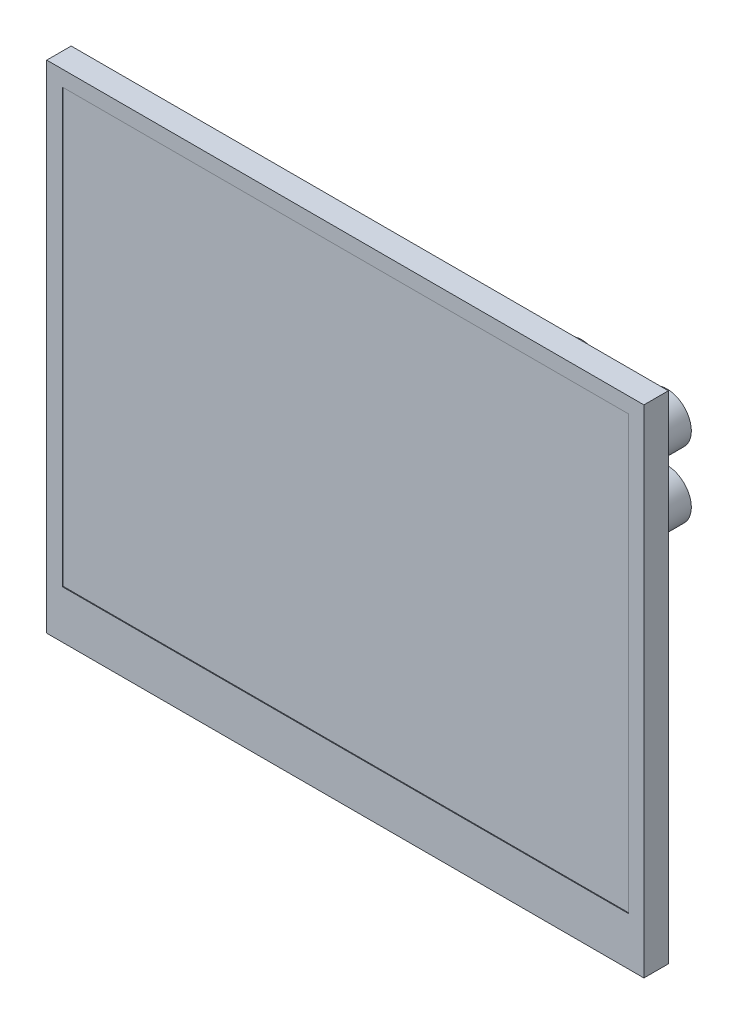
from build123d import *

# Parameters (mm, degrees)
SKETCH1_W           = 77
SKETCH1_H           = 64
BOSS_EXTRUDE1_DEPTH = 1.575
SKETCH2_W           = 56
SKETCH2_H           = 30
BOSS_EXTRUDE2_DEPTH = 4
SKETCH3_R           = 3.125
BOSS_EXTRUDE3_DEPTH = 6
SKETCH4_W           = 73
SKETCH4_H           = 55.8
CUT_EXTRUDE1_DEPTH  = 0.1


with BuildPart() as part:
    # Sketch1 → Boss-Extrude1 (new, symmetric)
    with BuildSketch(Plane.XY):
        Rectangle(SKETCH1_W, SKETCH1_H)
    extrude(amount=BOSS_EXTRUDE1_DEPTH, both=True)

    # Sketch2 → Boss-Extrude2 (add)
    with BuildSketch(Plane(origin=(0, 0, -1.575), x_dir=(-1, 0, 0), z_dir=(0, 0, -1))):
        with Locations((-6.5, 8.25)):
            Rectangle(SKETCH2_W, SKETCH2_H)
    extrude(amount=BOSS_EXTRUDE2_DEPTH)

    # Sketch3 → Boss-Extrude3 (add)
    with BuildSketch(Plane(origin=(0, 0, -5.575), x_dir=(-1, 0, 0), z_dir=(0, 0, -1))):
        with Locations((-28.335952563, 18.999270837)):
            Circle(SKETCH3_R)
        with Locations((-17.355937958, 18.999270837)):
            Circle(SKETCH3_R)
        with Locations((-28.335952563, 10.470489708)):
            Circle(SKETCH3_R)
        with BuildLine():
            Line((-6.150306614, 20.999270837), (0.349693386, 20.999270837))
            ThreePointArc((0.349693386, 20.999270837), (2.349693386, 18.999270837), (0.349693386, 16.999270837))
            Line((0.349693386, 16.999270837), (-6.150306614, 16.999270837))
            ThreePointArc((-6.150306614, 16.999270837), (-8.150306614, 18.999270837), (-6.150306614, 20.999270837))
        make_face()
    extrude(amount=BOSS_EXTRUDE3_DEPTH)

    # Sketch4 → Cut-Extrude1 (cut)
    with BuildSketch(Plane.XY.offset(1.575)):
        with Locations((0, 2.1)):
            Rectangle(SKETCH4_W, SKETCH4_H)
    extrude(amount=-CUT_EXTRUDE1_DEPTH, mode=Mode.SUBTRACT)


solid = part.part
